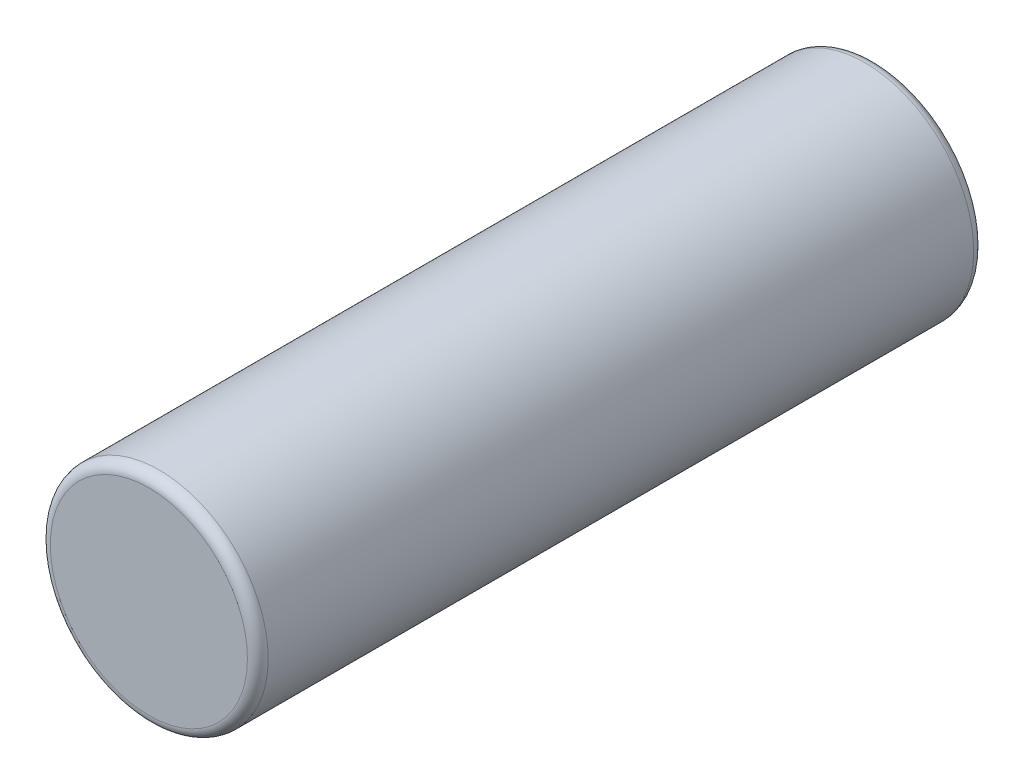
from build123d import *

# Parameters (mm, degrees)
SKETCH1_R           = 10.5
BOSS_EXTRUDE1_DEPTH = 70
FILLET1_R           = 1


with BuildPart() as part:
    # Sketch1 → Boss-Extrude1 (new body)
    with BuildSketch(Plane.XY):
        Circle(SKETCH1_R)
    extrude(amount=BOSS_EXTRUDE1_DEPTH)

    # Fillet1
    fillet1_edges = [part.edges().sort_by_distance(p)[0] for p in [
        (-10.5, 0, 0),
        (-10.5, 0, 70),
    ]]
    fillet(fillet1_edges, radius=FILLET1_R)


solid = part.part
